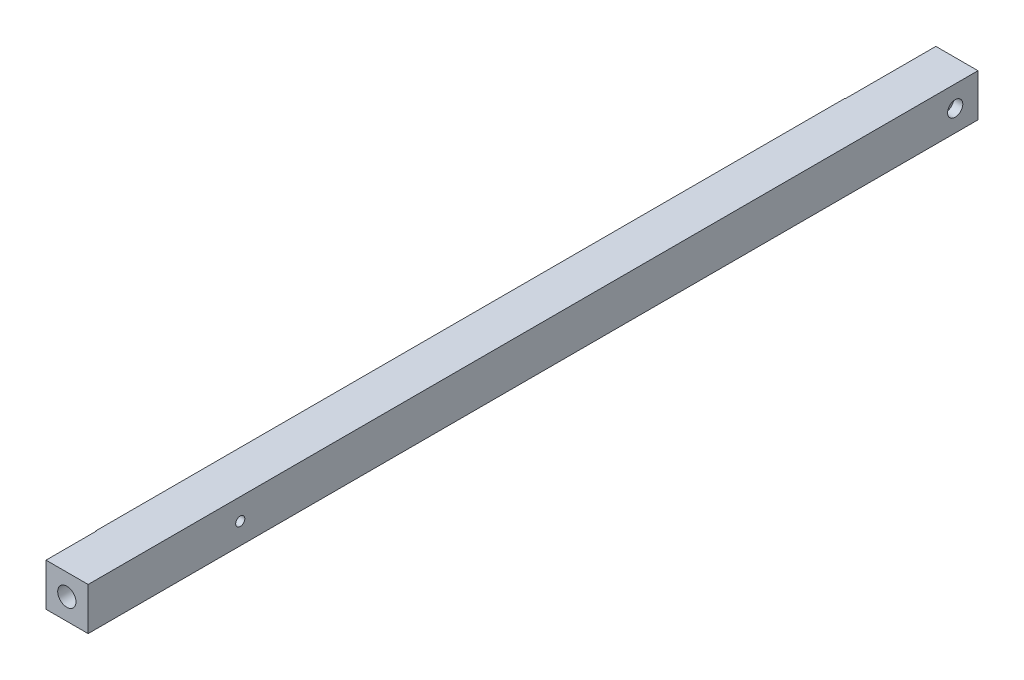
from build123d import *

# Parameters (mm, degrees)
IZIM1_W                     = 28
IZIM1_H                     = 28
Y_KSEKLIK_EKSTR_ZYON1_DEPTH = 585
IZIM2_R                     = 6
KES_EKSTR_ZYON1_DEPTH       = 60
SKETCH1_R                   = 3.5
CUT_EXTRUDE1_DEPTH          = 25
SKETCH3_R                   = 3
CUT_EXTRUDE2_DEPTH          = 586.837008049
SKETCH5_R                   = 4.25
CUT_EXTRUDE4_DEPTH          = 6
SKETCH6_W                   = 68.791406121
SKETCH6_H                   = 219.206637727
SKETCH6_W_2                 = 68.987868966
SKETCH6_H_2                 = 174.940464565
CUT_EXTRUDE5_DEPTH          = 0.3
SKETCH7_R                   = 3
CUT_EXTRUDE6_DEPTH          = 84
SKETCH8_R                   = 5
CUT_EXTRUDE7_DEPTH          = 6


with BuildPart() as part:
    # Çizim1 → Yükseklik-Ekstrüzyon1 (new body)
    with BuildSketch(Plane.XY):
        Rectangle(IZIM1_W, IZIM1_H)
    extrude(amount=Y_KSEKLIK_EKSTR_ZYON1_DEPTH)

    # Çizim2 → Kes-Ekstrüzyon1 (cut)
    with BuildSketch(Plane.XY.offset(585)):
        Circle(IZIM2_R)
    extrude(amount=-KES_EKSTR_ZYON1_DEPTH, mode=Mode.SUBTRACT)

    # Sketch1 → Cut-Extrude1 (cut)
    with BuildSketch(Plane(origin=(0, 0, 0), x_dir=(-1, 0, 0), z_dir=(0, 0, -1))):
        with Locations((-7, 7)):
            Circle(SKETCH1_R)
        with Locations((7, -7)):
            Circle(SKETCH1_R)
    extrude(amount=-CUT_EXTRUDE1_DEPTH, mode=Mode.SUBTRACT)

    # Sketch3 → Cut-Extrude2 (cut, through all)
    with BuildSketch(Plane.ZY.offset(14)):
        with Locations((485, 0)):
            Circle(SKETCH3_R)
    extrude(amount=-CUT_EXTRUDE2_DEPTH, mode=Mode.SUBTRACT)

    # Sketch5 → Cut-Extrude4 (cut)
    with BuildSketch(Plane.ZY.offset(14)):
        with Locations((485, 0)):
            Circle(SKETCH5_R)
    extrude(amount=-CUT_EXTRUDE4_DEPTH, mode=Mode.SUBTRACT)

    # Sketch6 → Cut-Extrude5 (cut)
    with BuildSketch(Plane.ZY.offset(14)):
        with Locations((586.39570306, 18.878857334)):
            Rectangle(SKETCH6_W, SKETCH6_H)
        with Locations((25.006065517, 7.665656751)):
            Rectangle(SKETCH6_W_2, SKETCH6_H_2)
    extrude(amount=-CUT_EXTRUDE5_DEPTH, mode=Mode.SUBTRACT)

    # Sketch7 → Cut-Extrude6 (cut)
    with BuildSketch(Plane(origin=(14, 0, 0), x_dir=(0, 0, -1), z_dir=(1, 0, 0))):
        with Locations((-15, 0)):
            Circle(SKETCH7_R)
    extrude(amount=-CUT_EXTRUDE6_DEPTH, mode=Mode.SUBTRACT)

    # Sketch8 → Cut-Extrude7 (cut)
    with BuildSketch(Plane(origin=(14, 0, 0), x_dir=(0, 0, -1), z_dir=(1, 0, 0))):
        with Locations((-15, 0)):
            Circle(SKETCH8_R)
    extrude(amount=-CUT_EXTRUDE7_DEPTH, mode=Mode.SUBTRACT)


solid = part.part
